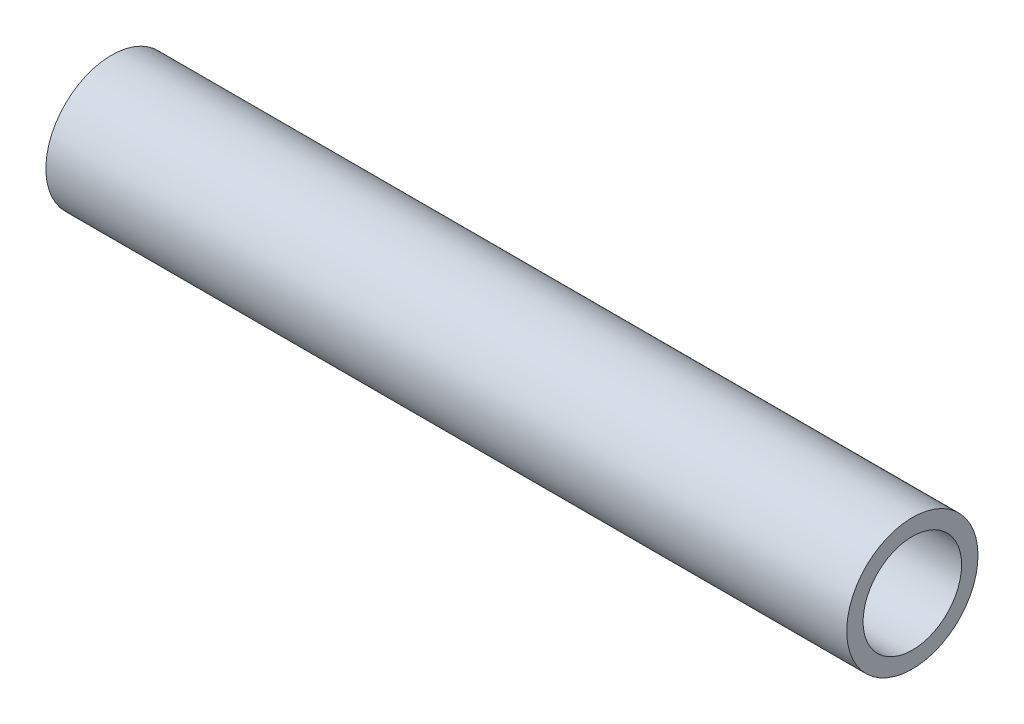
from build123d import *

# Parameters (mm, degrees)
SKETCH1_R           = 6.35
SKETCH1_R_2         = 4.7625
BOSS_EXTRUDE1_DEPTH = 77.47


with BuildPart() as part:
    # Sketch1 → Boss-Extrude1 (new body)
    with BuildSketch(Plane(origin=(0, 0, 0), x_dir=(0, -1, 0), z_dir=(1, 0, 0))):
        with Locations(Location((0, 0, 0), (0, 0, 90))):
            Circle(SKETCH1_R)
        with Locations(Location((0, 0, 0), (0, 0, 90))):
            Circle(SKETCH1_R_2, mode=Mode.SUBTRACT)
    extrude(amount=BOSS_EXTRUDE1_DEPTH)


solid = part.part
